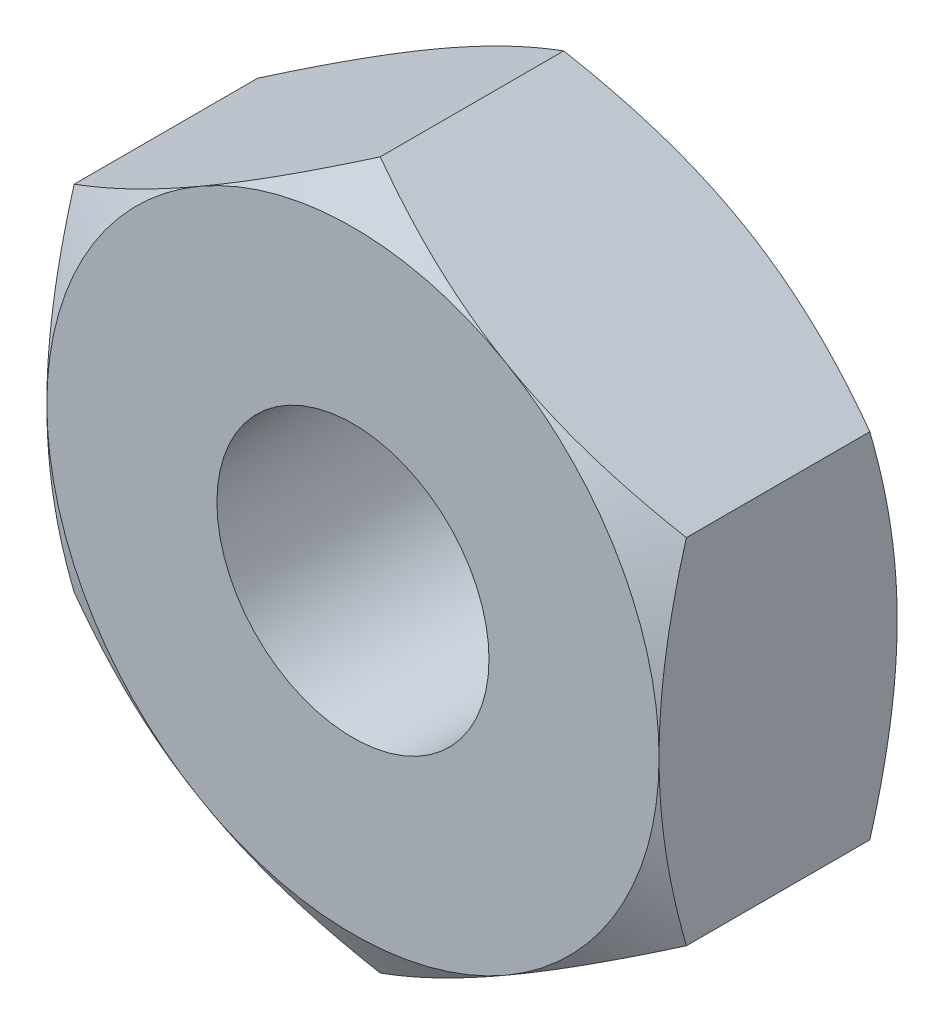
from build123d import *

# Parameters (mm, degrees)
SKETCH1_R           = 1
BOSS_EXTRUDE1_DEPTH = 1.75
SKETCH2_R           = 3.798357005
SKETCH2_R_2         = 2.25
CUT_EXTRUDE1_DEPTH  = 2
CUT_EXTRUDE1_TAPER  = 60
SKETCH3_R           = 3.513551011
SKETCH3_R_2         = 2.25
CUT_EXTRUDE2_DEPTH  = 2
CUT_EXTRUDE2_TAPER  = 60
SCALE1_SCALE        = 18


with BuildPart() as part:
    # Sketch1 → Boss-Extrude1 (new body)
    with BuildSketch(Plane.XY):
        Polygon((2.25, 1.299038106), (0, 2.598076211), (-2.25, 1.299038106), (-2.25, -1.299038106), (0, -2.598076211), (2.25, -1.299038106), align=None)
        Circle(SKETCH1_R, mode=Mode.SUBTRACT)
    extrude(amount=BOSS_EXTRUDE1_DEPTH)

    # Sketch2 → Cut-Extrude1 (cut)
    with BuildSketch(Plane.XY.offset(1.75)):
        Circle(SKETCH2_R)
        Circle(SKETCH2_R_2, mode=Mode.SUBTRACT)
    extrude(amount=-CUT_EXTRUDE1_DEPTH, taper=CUT_EXTRUDE1_TAPER, mode=Mode.SUBTRACT)

    # Sketch3 → Cut-Extrude2 (cut)
    with BuildSketch(Plane(origin=(0, 0, 0), x_dir=(-1, 0, 0), z_dir=(0, 0, -1))):
        Circle(SKETCH3_R)
        Circle(SKETCH3_R_2, mode=Mode.SUBTRACT)
    extrude(amount=-CUT_EXTRUDE2_DEPTH, taper=CUT_EXTRUDE2_TAPER, mode=Mode.SUBTRACT)


with BuildPart() as part_1:
    # Scale1: scaled about (0, 0, 0.875)
    add(part.part.scale(SCALE1_SCALE).moved(Location((0, 0, -14.875))))


solid = part_1.part
